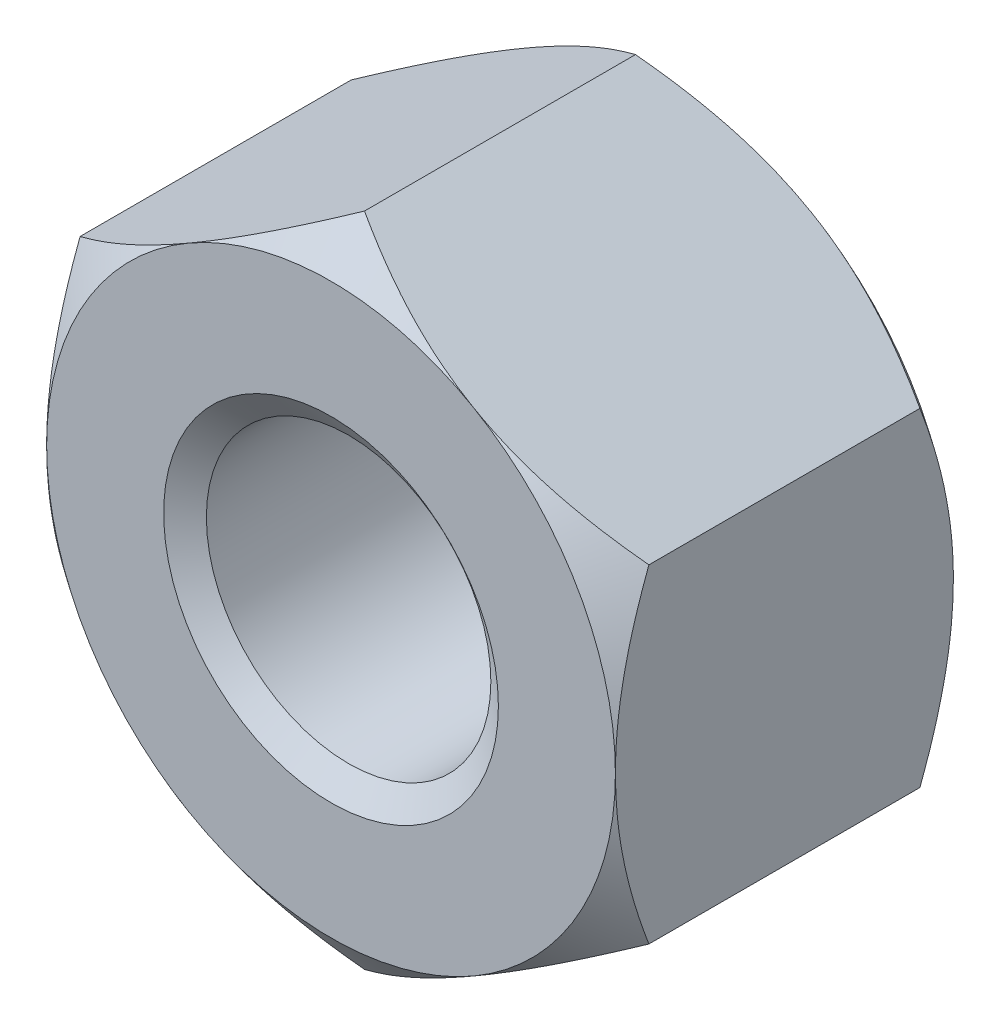
from build123d import *

# Parameters (mm, degrees)
BASENUT_START = -16.0274
BASENUTSKE_R  = 6.74624
BASENUT_DEPTH = 16.0274


with BuildPart() as part:
    # BaseNutSke → BaseNut (new body)
    with BuildSketch(Plane.XY.offset(BASENUT_START)):
        Polygon((13.4874, 7.786954021), (13.4874, -7.786954021), (0, -15.573908041), (-13.4874, -7.786954021), (-13.4874, 7.786954021), (0, 15.573908041), align=None)
        Circle(BASENUTSKE_R, mode=Mode.SUBTRACT)
    extrude(amount=BASENUT_DEPTH)

    # Sketch3 → Double-Chamfer (revolve, cut)
    with BuildSketch(Plane(origin=(0, 0, 0), x_dir=(0, 0, -1), z_dir=(1, 0, 0))):
        Polygon((16.0274, 13.4874), (14.4399, 15.573908041), (14.4399, 28.273908041), (28.7274, 28.273908041), (28.7274, 13.4874), align=None)
        Polygon((1.5875, 28.273908041), (-12.7, 28.273908041), (-12.7, 13.4874), (0, 13.4874), (1.5875, 15.573908041), align=None)
    revolve(axis=Axis((0, 0, 0), (0, 0, -1)), mode=Mode.SUBTRACT)

    # Sketch5 → EndChamfer (revolve, cut)
    with BuildSketch(Plane(origin=(0, 0, 0), x_dir=(0, 0, -1), z_dir=(1, 0, 0)), mode=Mode.PRIVATE) as endchamfer_sk:
        Polygon((16.002, 7.9375), (15.084457845, 6.627114), (16.0528, 6.627114), (16.0528, 7.9375), align=None)
        Polygon((-0.0508, 7.9375), (0, 7.9375), (0.917542155, 6.627114), (-0.0508, 6.627114), align=None)
    revolve(endchamfer_sk.sketch.rotate(Axis((0, 0, -25.037505729), (0, 0, -1)), 90), axis=Axis((0, 0, -25.037505729), (0, 0, -1)), mode=Mode.SUBTRACT)


solid = part.part
